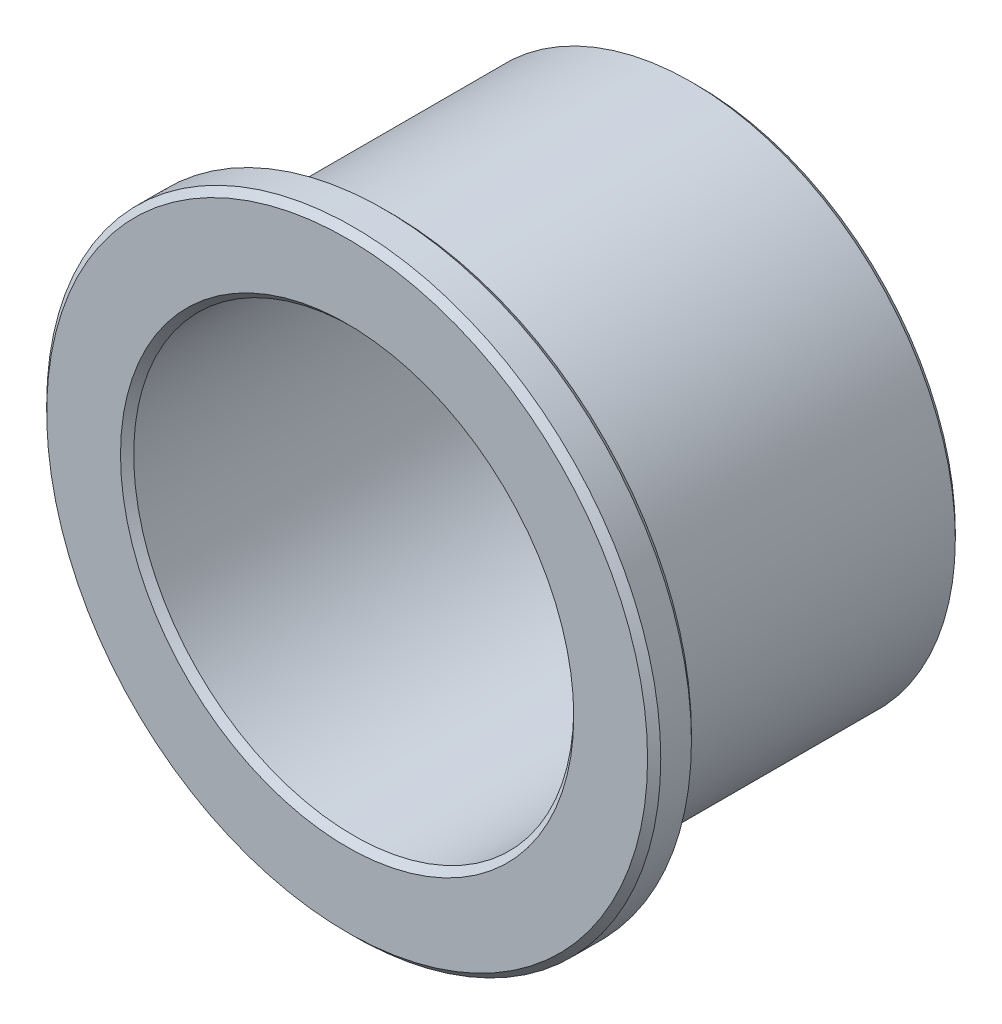
from build123d import *

# Parameters (mm, degrees)
BOSS_EXTRUDE1_START = 6.35
SKETCH3_R           = 11.1125
SKETCH3_R_2         = 7.9629
BOSS_EXTRUDE1_DEPTH = 1.5875
BOSS_EXTRUDE2_START = 4.7625
SKETCH4_R           = 9.5504
SKETCH4_R_2         = 7.9629
BOSS_EXTRUDE2_DEPTH = 11.1125
CHAMFER1_SIZE       = 0.238887


with BuildPart() as part:
    # Sketch3 → Boss-Extrude1 (new body)
    with BuildSketch(Plane.XY.offset(BOSS_EXTRUDE1_START)):
        Circle(SKETCH3_R)
        Circle(SKETCH3_R_2, mode=Mode.SUBTRACT)
    extrude(amount=-BOSS_EXTRUDE1_DEPTH)

    # Sketch4 → Boss-Extrude2 (add)
    with BuildSketch(Plane.XY.offset(BOSS_EXTRUDE2_START)):
        Circle(SKETCH4_R)
        Circle(SKETCH4_R_2, mode=Mode.SUBTRACT)
    extrude(amount=-BOSS_EXTRUDE2_DEPTH)

    # Chamfer1
    chamfer1_edges = [part.edges().sort_by_distance(p)[0] for p in [
        (-7.9629, 0, -6.35),
        (-9.5504, 0, 4.7625),
        (-11.1125, 0, 6.35),
        (-11.1125, 0, 4.7625),
        (-7.9629, 0, 6.35),
        (-9.5504, 0, -6.35),
    ]]
    chamfer(chamfer1_edges, length=CHAMFER1_SIZE)


solid = part.part
